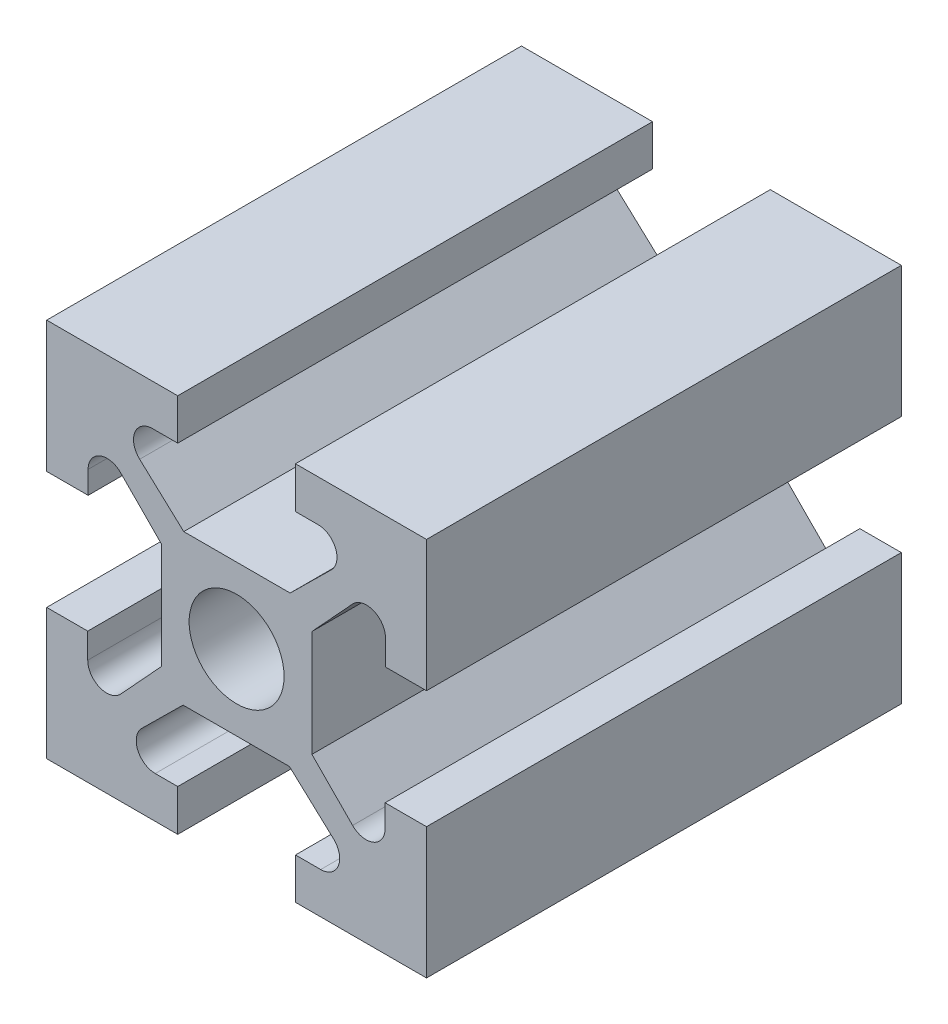
from build123d import *

# Parameters (mm, degrees)
SKETCH2_R           = 2.5
BOSS_EXTRUDE1_DEPTH = 25


with BuildPart() as part:
    # Sketch2 → Boss-Extrude1 (new body)
    with BuildSketch(Plane.XY):
        with BuildLine():
            Line((-10, -10), (-3.1, -10))
            Line((-3.1, -10), (-3.1, -7.81857447))
            Line((-3.1, -7.81857447), (-4.285374034, -7.81857447))
            ThreePointArc((-4.285374034, -7.81857447), (-5.210402021, -7.198473435), (-4.988208383, -6.107220917))
            Line((-4.988208383, -6.107220917), (-2.819718275, -3.96470075))
            Line((-2.819718275, -3.96470075), (0, -3.96470075))
            Line((0, -3.96470075), (2.782738033, -3.96470075))
            Line((2.782738033, -3.96470075), (5.105242131, -6.103332486))
            ThreePointArc((5.105242131, -6.103332486), (5.359419929, -7.202533996), (4.427854938, -7.838959152))
            Line((4.427854938, -7.838959152), (3.1, -7.838959152))
            Line((3.1, -7.838959152), (3.1, -10))
            Line((3.1, -10), (10, -10))
            Line((10, -10), (10, -3.1))
            Line((10, -3.1), (7.81857447, -3.1))
            Line((7.81857447, -3.1), (7.81857447, -4.285374034))
            ThreePointArc((7.81857447, -4.285374034), (7.198473435, -5.210402021), (6.107220917, -4.988208383))
            Line((6.107220917, -4.988208383), (3.96470075, -2.819718275))
            Line((3.96470075, -2.819718275), (3.96470075, 0))
            Line((3.96470075, 0), (3.96470075, 2.782738033))
            Line((3.96470075, 2.782738033), (6.103332486, 5.105242131))
            ThreePointArc((6.103332486, 5.105242131), (7.202533996, 5.359419929), (7.838959152, 4.427854938))
            Line((7.838959152, 4.427854938), (7.838959152, 3.1))
            Line((7.838959152, 3.1), (10, 3.1))
            Line((10, 3.1), (10, 10))
            Line((10, 10), (3.1, 10))
            Line((3.1, 10), (3.1, 7.81857447))
            Line((3.1, 7.81857447), (4.285374034, 7.81857447))
            ThreePointArc((4.285374034, 7.81857447), (5.210402021, 7.198473435), (4.988208383, 6.107220917))
            Line((4.988208383, 6.107220917), (2.819718275, 3.96470075))
            Line((2.819718275, 3.96470075), (0, 3.96470075))
            Line((0, 3.96470075), (-2.782738033, 3.96470075))
            Line((-2.782738033, 3.96470075), (-5.105242131, 6.103332486))
            ThreePointArc((-5.105242131, 6.103332486), (-5.359419929, 7.202533996), (-4.427854938, 7.838959152))
            Line((-4.427854938, 7.838959152), (-3.1, 7.838959152))
            Line((-3.1, 7.838959152), (-3.1, 10))
            Line((-3.1, 10), (-10, 10))
            Line((-10, 10), (-10, 3.1))
            Line((-10, 3.1), (-7.81857447, 3.1))
            Line((-7.81857447, 3.1), (-7.81857447, 4.285374034))
            ThreePointArc((-7.81857447, 4.285374034), (-7.198473435, 5.210402021), (-6.107220917, 4.988208383))
            Line((-6.107220917, 4.988208383), (-3.96470075, 2.819718275))
            Line((-3.96470075, 2.819718275), (-3.96470075, 0))
            Line((-3.96470075, 0), (-3.96470075, -2.782738033))
            Line((-3.96470075, -2.782738033), (-6.103332486, -5.105242131))
            ThreePointArc((-6.103332486, -5.105242131), (-7.202533996, -5.359419929), (-7.838959152, -4.427854938))
            Line((-7.838959152, -4.427854938), (-7.838959152, -3.1))
            Line((-7.838959152, -3.1), (-10, -3.1))
            Line((-10, -3.1), (-10, -10))
        make_face()
        Circle(SKETCH2_R, mode=Mode.SUBTRACT)
    extrude(amount=BOSS_EXTRUDE1_DEPTH)


solid = part.part
